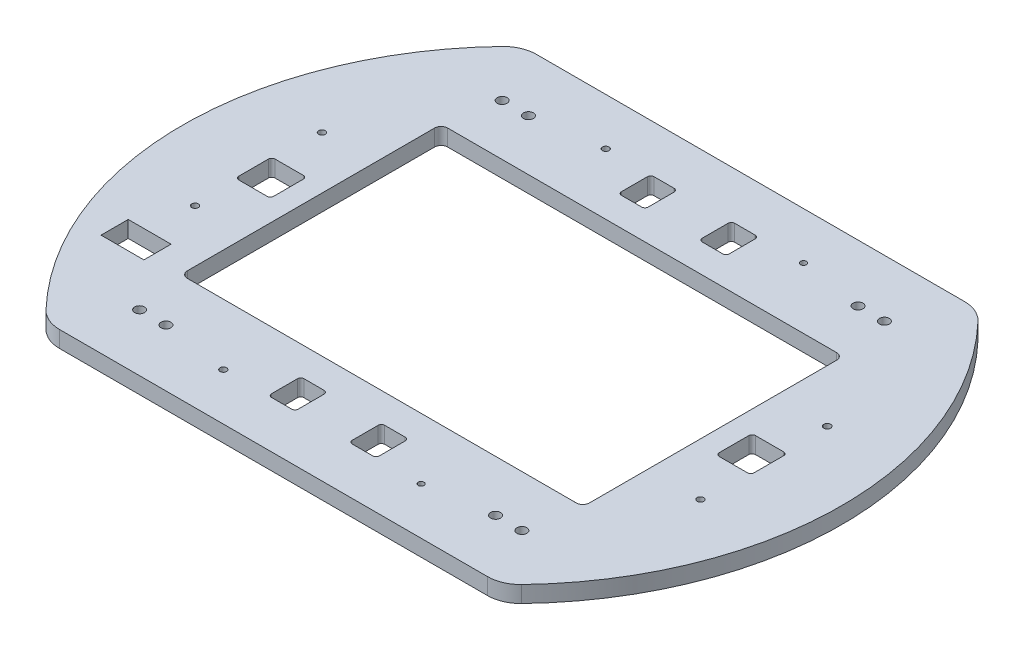
from build123d import *

# Parameters (mm, degrees)
RESSALTO_EXTRUS_O1_DEPTH  = 5
FILETE1_R                 = 10
ESBO_O4_R                 = 1.5
CORTE_EXTRUS_O3_DEPTH     = 124.512688994
ESPELHAR4_COPY_1_SKETCH_R = 1.5
ESPELHAR4_COPY_1_DEPTH    = 124.512688994
SKETCH1_W                 = 122
SKETCH1_H                 = 79
CUT_EXTRUDE1_DEPTH        = 124.512688994
FILLET2_R                 = 2
ESBO_O6_R                 = 1
CORTE_EXTRUS_O4_DEPTH     = 124.512688994
ESBO_O8_R                 = 1
ESBO_O8_R_2               = 1.042538076
CORTE_EXTRUS_O5_DEPTH     = 124.512688994
ESBO_O12_W                = 13
ESBO_O12_H                = 8.25
CORTE_EXTRUS_O7_DEPTH     = 124.512688994
ESBO_O13_R                = 1.5
CORTE_EXTRUS_O8_DEPTH     = 124.512688994
ESBO_O14_R                = 1
ESBO_O14_R_2              = 0.885907966
CORTE_EXTRUS_O9_DEPTH     = 124.512688994


with BuildPart() as part:
    # Esboço1 → Ressalto-extrusão1 (new body)
    with BuildSketch(Plane(origin=(0, 0, 0), x_dir=(1, 0, 0), z_dir=(0, 1, 0))):
        with BuildLine():
            Line((-69.062404082, -72.321396159), (69.062404082, -72.321396159))
            ThreePointArc((69.062404082, -72.321396159), (100, 0), (69.062404082, 72.321396159))
            Line((69.062404082, 72.321396159), (-69.062404082, 72.321396159))
            ThreePointArc((-69.062404082, 72.321396159), (-100, 0), (-69.062404082, -72.321396159))
        make_face()
    extrude(amount=RESSALTO_EXTRUS_O1_DEPTH)

    # Filete1
    filete1_edges = [part.edges().sort_by_distance(p)[0] for p in [
        (-69.062404082, 2.5, -72.321396159),
        (69.062404082, 2.5, -72.321396159),
        (69.062404082, 2.5, 72.321396159),
        (-69.062404082, 2.5, 72.321396159),
    ]]
    fillet(filete1_edges, radius=FILETE1_R)

    # Esboço4 → Corte-extrusão3 (cut, through all)
    with BuildSketch(Plane(origin=(0, 5, 0), x_dir=(1, 0, 0), z_dir=(0, 1, 0))):
        with Locations(Location((-50, 55, 0), (0, 0, 270))):
            Circle(ESBO_O4_R)
    corte_extrus_o3 = extrude(amount=-CORTE_EXTRUS_O3_DEPTH, mode=Mode.SUBTRACT)

    # Espelhar3: Corte-extrusão3 across plane
    add(corte_extrus_o3.mirror(Plane(origin=(0, 0, 0), x_dir=(0, 0, 1), z_dir=(1, 0, 0))), mode=Mode.SUBTRACT)

    # Espelhar4: Corte-extrusão3 across plane
    add(corte_extrus_o3.mirror(Plane.XY), mode=Mode.SUBTRACT)

    # Espelhar4 copy 1 sketch → Espelhar4 copy 1 (cut, through all)
    with BuildSketch(Plane(origin=(0, 5, 0), x_dir=(-1, 0, 0), z_dir=(0, 1, 0))):
        with Locations(Location((-50, 55, 0), (0, 0, 270))):
            Circle(ESPELHAR4_COPY_1_SKETCH_R)
    extrude(amount=-ESPELHAR4_COPY_1_DEPTH, mode=Mode.SUBTRACT)

    # Sketch1 → Cut-Extrude1 (cut, through all)
    with BuildSketch(Plane(origin=(0, 5, 0), x_dir=(1, 0, 0), z_dir=(0, 1, 0))):
        Rectangle(SKETCH1_W, SKETCH1_H)
    extrude(amount=-CUT_EXTRUDE1_DEPTH, mode=Mode.SUBTRACT)

    # Fillet2
    fillet2_edges = [part.edges().sort_by_distance(p)[0] for p in [
        (-61, 2.5, 39.5),
        (-61, 2.5, -39.5),
        (61, 2.5, -39.5),
        (61, 2.5, 39.5),
    ]]
    fillet(fillet2_edges, radius=FILLET2_R)

    # Esboço6 → Corte-extrusão4 (cut, through all)
    with BuildSketch(Plane(origin=(0, 5, 0), x_dir=(1, 0, 0), z_dir=(0, 1, 0))):
        with Locations(Location((-76.920436381, 19.236111974, 0), (0, 0, 270))):
            Circle(ESBO_O6_R)
        with Locations(Location((-76.920436293, -19.238117897, 0), (0, 0, 270))):
            Circle(ESBO_O6_R)
    extrude(amount=-CORTE_EXTRUS_O4_DEPTH, mode=Mode.SUBTRACT)

    # Esboço8 → Corte-extrusão5 (cut, through all)
    with BuildSketch(Plane(origin=(0, 5, 0), x_dir=(1, 0, 0), z_dir=(0, 1, 0))):
        with Locations(Location((76.920436129, -19.756156804, 0), (0, 0, 270))):
            Circle(ESBO_O8_R)
        with Locations(Location((76.920436041, 18.718073068, 0), (0, 0, 270))):
            Circle(ESBO_O8_R_2)
        with BuildLine():
            Line((77.058773716, -5.618000613), (68.478773716, -5.618000613))
            ThreePointArc((68.478773716, -5.618000613), (67.771666935, -5.325107395), (67.478773716, -4.618000613))
            Line((67.478773716, -4.618000613), (67.478773716, 4.381999387))
            ThreePointArc((67.478773716, 4.381999387), (67.771666935, 5.089106168), (68.478773716, 5.381999387))
            Line((68.478773716, 5.381999387), (77.058773716, 5.381999387))
            ThreePointArc((77.058773716, 5.381999387), (77.765880497, 5.089106168), (78.058773716, 4.381999387))
            Line((78.058773716, 4.381999387), (78.058773716, -4.618000613))
            ThreePointArc((78.058773716, -4.618000613), (77.765880497, -5.325107395), (77.058773716, -5.618000613))
        make_face()
    extrude(amount=-CORTE_EXTRUS_O5_DEPTH, mode=Mode.SUBTRACT)

    # Esboço12 → Corte-extrusão7 (cut, through all)
    with BuildSketch(Plane(origin=(0, 5, 0), x_dir=(1, 0, 0), z_dir=(0, 1, 0))):
        with Locations((-76.958855033, -37.107917316)):
            Rectangle(ESBO_O12_W, ESBO_O12_H)
        with BuildLine():
            Line((-77.058773716, 5.160452578), (-68.478773716, 5.160452578))
            ThreePointArc((-68.478773716, 5.160452578), (-67.771666935, 4.867559359), (-67.478773716, 4.160452578))
            Line((-67.478773716, 4.160452578), (-67.478773716, -4.839547422))
            ThreePointArc((-67.478773716, -4.839547422), (-67.771666935, -5.546654203), (-68.478773716, -5.839547422))
            Line((-68.478773716, -5.839547422), (-77.058773716, -5.839547422))
            ThreePointArc((-77.058773716, -5.839547422), (-77.765880497, -5.546654203), (-78.058773716, -4.839547422))
            Line((-78.058773716, -4.839547422), (-78.058773716, 4.160452578))
            ThreePointArc((-78.058773716, 4.160452578), (-77.765880497, 4.867559359), (-77.058773716, 5.160452578))
        make_face()
    extrude(amount=-CORTE_EXTRUS_O7_DEPTH, mode=Mode.SUBTRACT)

    # Esboço13 → Corte-extrusão8 (cut, through all)
    with BuildSketch(Plane(origin=(0, 5, 0), x_dir=(1, 0, 0), z_dir=(0, 1, 0))):
        with Locations(Location((-58, -55, 0), (0, 0, 270))):
            Circle(ESBO_O13_R)
        with Locations(Location((58, -55, 0), (0, 0, 90))):
            Circle(ESBO_O13_R)
        with Locations(Location((58, 55, 0), (0, 0, 270))):
            Circle(ESBO_O13_R)
        with Locations(Location((-58, 55, 0), (0, 0, 90))):
            Circle(ESBO_O13_R)
    extrude(amount=-CORTE_EXTRUS_O8_DEPTH, mode=Mode.SUBTRACT)

    # Esboço14 → Corte-extrusão9 (cut, through all)
    with BuildSketch(Plane(origin=(0, 5, 0), x_dir=(1, 0, 0), z_dir=(0, 1, 0))):
        with Locations(Location((-29.57071729, -58.018271029, 0), (0, 0, 270))):
            Circle(ESBO_O14_R)
        with Locations(Location((30.42928271, -58.018271029, 0), (0, 0, 270))):
            Circle(ESBO_O14_R_2)
        with BuildLine():
            Line((-14.930567591, -48.170190889), (-8.830173292, -48.170190889))
            ThreePointArc((-8.830173292, -48.170190889), (-8.123066511, -48.463084108), (-7.830173292, -49.170190889))
            Line((-7.830173292, -49.170190889), (-7.830173292, -57.018271029))
            ThreePointArc((-7.830173292, -57.018271029), (-8.123066511, -57.72537781), (-8.830173292, -58.018271029))
            Line((-8.830173292, -58.018271029), (-14.930567591, -58.018271029))
            ThreePointArc((-14.930567591, -58.018271029), (-15.637674372, -57.72537781), (-15.930567591, -57.018271029))
            Line((-15.930567591, -57.018271029), (-15.930567591, -49.170190889))
            ThreePointArc((-15.930567591, -49.170190889), (-15.637674372, -48.463084108), (-14.930567591, -48.170190889))
        make_face()
        with BuildLine():
            Line((9.546710766, -48.170190889), (15.764502084, -48.170190889))
            ThreePointArc((15.764502084, -48.170190889), (16.471608865, -48.463084108), (16.764502084, -49.170190889))
            Line((16.764502084, -49.170190889), (16.764502084, -57.018271029))
            ThreePointArc((16.764502084, -57.018271029), (16.471608865, -57.72537781), (15.764502084, -58.018271029))
            Line((15.764502084, -58.018271029), (9.546710766, -58.018271029))
            ThreePointArc((9.546710766, -58.018271029), (8.839603985, -57.72537781), (8.546710766, -57.018271029))
            Line((8.546710766, -57.018271029), (8.546710766, -49.170190889))
            ThreePointArc((8.546710766, -49.170190889), (8.839603985, -48.463084108), (9.546710766, -48.170190889))
        make_face()
    corte_extrus_o9 = extrude(amount=-CORTE_EXTRUS_O9_DEPTH, mode=Mode.SUBTRACT)

    # Espelhar5: Corte-extrusão9 across plane
    add(corte_extrus_o9.mirror(Plane.XY), mode=Mode.SUBTRACT)


solid = part.part
